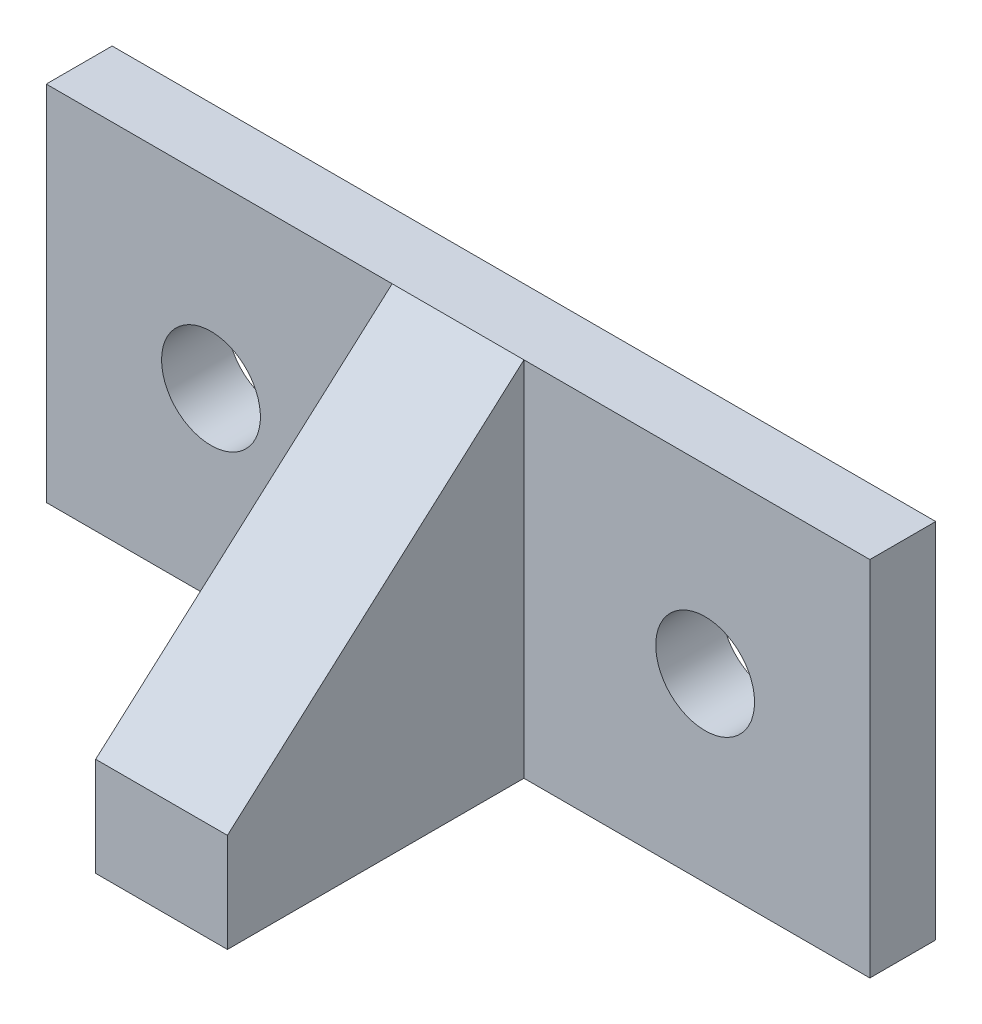
from build123d import *

# Parameters (mm, degrees)
SKETCH1_W           = 10
SKETCH1_H           = 55
BOSS_EXTRUDE1_DEPTH = 62.5
BOSS_EXTRUDE2_DEPTH = 10
SKETCH2_R           = 7.5
CUT_EXTRUDE1_DEPTH  = 10


with BuildPart() as part:
    # Sketch1 → Boss-Extrude1 (new, symmetric)
    with BuildSketch(Plane(origin=(0, 0, 0), x_dir=(0, 0, -1), z_dir=(1, 0, 0))):
        with Locations((5, 27.5)):
            Rectangle(SKETCH1_W, SKETCH1_H)
    extrude(amount=BOSS_EXTRUDE1_DEPTH, both=True)

    # Sketch1<3> → Boss-Extrude2 (add, symmetric)
    with BuildSketch(Plane(origin=(0, 0, 0), x_dir=(0, 0, -1), z_dir=(1, 0, 0))):
        Polygon((0, 0), (0, 55), (-45, 15), (-45, 0), align=None)
    extrude(amount=BOSS_EXTRUDE2_DEPTH, both=True)

    # Sketch2 → Cut-Extrude1 (cut)
    with BuildSketch(Plane.XY):
        with Locations((37.5, 27.5)):
            Circle(SKETCH2_R)
    cut_extrude1 = extrude(amount=-CUT_EXTRUDE1_DEPTH, mode=Mode.SUBTRACT)

    # Mirror1: Cut-Extrude1 across plane
    add(cut_extrude1.mirror(Plane(origin=(0, 0, 0), x_dir=(0, 0, 1), z_dir=(1, 0, 0))), mode=Mode.SUBTRACT)


solid = part.part
